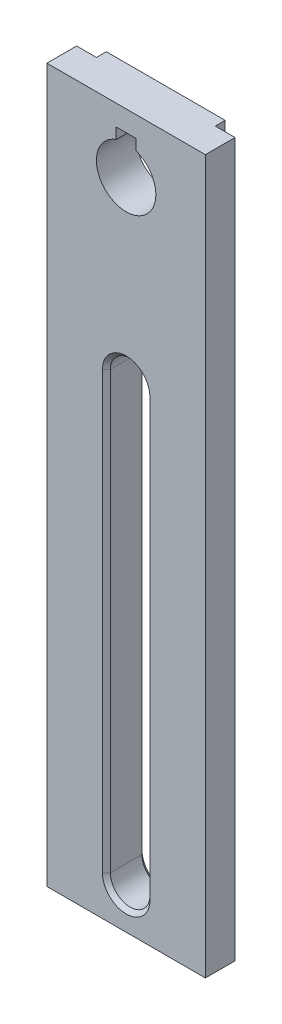
from build123d import *

# Parameters (mm, degrees)
SZKIC1_W                    = 40
SZKIC1_H                    = 180
DODANIE_WYCI_GNI_CIE1_DEPTH = 10
SZKIC2_W                    = 5
SZKIC2_H                    = 2.5
WYTNIJ_WYCI_GNI_CIE1_DEPTH  = 182.383571472
SFAZOWANIE1_SIZE            = 1


with BuildPart() as part:
    # Szkic1 → Dodanie-wyciągnięcie1 (new body)
    with BuildSketch(Plane.XY):
        with Locations((0, 110)):
            Rectangle(SZKIC1_W, SZKIC1_H)
        with BuildLine():
            Line((2.5, 194.8), (-2.5, 194.8))
            Line((-2.5, 194.8), (-2.5, 192.071067812))
            ThreePointArc((-2.5, 192.071067812), (0, 177.5), (2.5, 192.071067812))
            Line((2.5, 192.071067812), (2.5, 194.8))
        make_face(mode=Mode.SUBTRACT)
        with BuildLine():
            Line((5, 140), (5, 30))
            ThreePointArc((5, 30), (0, 25), (-5, 30))
            Line((-5, 30), (-5, 140))
            ThreePointArc((-5, 140), (0, 145), (5, 140))
        make_face(mode=Mode.SUBTRACT)
    extrude(amount=DODANIE_WYCI_GNI_CIE1_DEPTH)

    # Szkic2 → Wytnij-wyciągnięcie1 (cut, through all)
    with BuildSketch(Plane(origin=(0, 200, 0), x_dir=(1, 0, 0), z_dir=(0, 1, 0))):
        with Locations((-17.5, -1.25)):
            Rectangle(SZKIC2_W, SZKIC2_H)
        with Locations((17.5, -1.25)):
            Rectangle(SZKIC2_W, SZKIC2_H)
    extrude(amount=-WYTNIJ_WYCI_GNI_CIE1_DEPTH, mode=Mode.SUBTRACT)

    # Sfazowanie1
    sfazowanie1_edges = [part.edges().sort_by_distance(p)[0] for p in [
        (0, 145, 0),
        (-5, 85, 0),
        (0, 25, 0),
        (5, 85, 0),
        (0, 145, 10),
        (-5, 85, 10),
        (0, 25, 10),
        (5, 85, 10),
    ]]
    chamfer(sfazowanie1_edges, length=SFAZOWANIE1_SIZE)


solid = part.part
